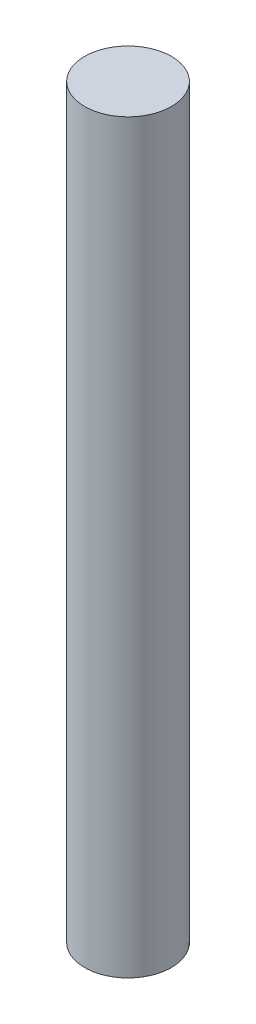
from build123d import *

# Parameters (mm, degrees)
SKETCH1_R           = 10.795
BOSS_EXTRUDE1_DEPTH = 185.42


with BuildPart() as part:
    # Sketch1 → Boss-Extrude1 (new body)
    with BuildSketch(Plane(origin=(0, 0, 0), x_dir=(1, 0, 0), z_dir=(0, 1, 0))):
        with Locations(Location((0, 0, 0), (0, 0, 90))):
            Circle(SKETCH1_R)
    extrude(amount=BOSS_EXTRUDE1_DEPTH)


solid = part.part
